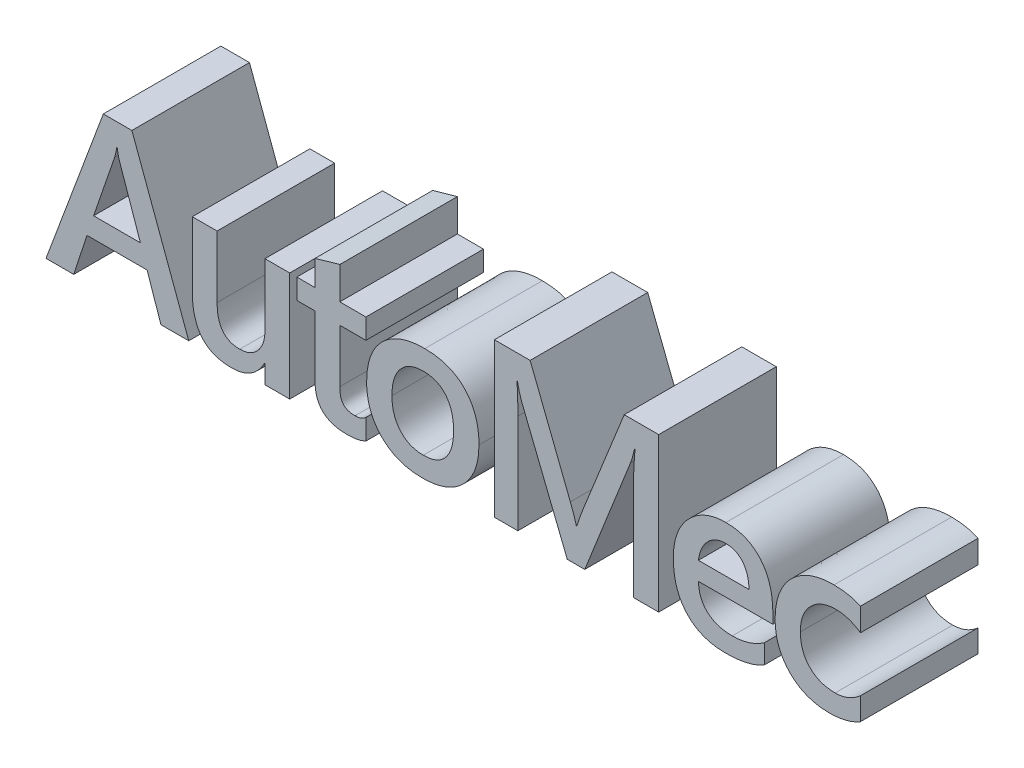
from build123d import *

# Parameters (mm, degrees)
BOSS_EXTRUDE1_DEPTH   = 26
BOSS_EXTRUDE1_2_DEPTH = 26
BOSS_EXTRUDE1_3_DEPTH = 26
BOSS_EXTRUDE1_4_DEPTH = 26
BOSS_EXTRUDE1_5_DEPTH = 26
BOSS_EXTRUDE1_6_DEPTH = 26
BOSS_EXTRUDE1_7_DEPTH = 26


with BuildPart() as part:
    # Sketch1 → Boss-Extrude1 (new body)
    with BuildSketch(Plane.XY):
        Polygon((31.965871711, 0), (25.807565789, 0), (22.766858553, 8.947368421), (9.457648026, 8.947368421), (6.535773026, 0), (0.3984375, 0), (13.071546053, 34), (19.390625, 34), align=None)
        with BuildLine():
            Line((21.277960526, 13.421052632), (16.587582237, 26.932976974))
            add(Edge.make_bspline(
                [(16.587582237, 26.932976974), (16.548101045, 27.060575153), (16.459275885, 27.347646749), (16.367014618, 27.839645061), (16.239400169, 28.423737496), (16.174856897, 28.850100474), (16.140213816, 29.078947368)],
                knots=[0, 0, 0, 0, 0.729984796, 1.642326725, 2.734537859, 4, 4, 4, 4], degree=3))
            Line((16.140213816, 29.078947368), (16.042351974, 29.078947368))
            add(Edge.make_bspline(
                [(16.042351974, 29.078947368), (16.009674078, 28.864165636), (15.947638546, 28.456425206), (15.825299172, 27.886844553), (15.710174952, 27.383968641), (15.617503708, 27.077025279), (15.574013158, 26.932976974)],
                knots=[0, 0, 0, 0, 1.185466323, 2.250482591, 3.1789527, 4, 4, 4, 4], degree=3))
            Line((15.574013158, 26.932976974), (10.925575658, 13.421052632))
            Line((10.925575658, 13.421052632), (21.277960526, 13.421052632))
        make_face(mode=Mode.SUBTRACT)
    extrude(amount=BOSS_EXTRUDE1_DEPTH)


with BuildPart() as body_2:
    # Sketch1 → Boss-Extrude1 2 (new body)
    with BuildSketch(Plane.XY):
        with BuildLine():
            Line((54.29375, 0), (48.820476974, 0))
            Line((48.820476974, 0), (48.820476974, 4.075246711))
            Line((48.820476974, 4.075246711), (48.722615132, 4.075246711))
            add(Edge.make_bspline(
                [(48.722615132, 4.075246711), (48.519935144, 3.715057326), (48.126604746, 3.016056721), (47.39560065, 2.091776269), (46.587459374, 1.308026839), (45.69578099, 0.659377738), (44.715132669, 0.162634197), (43.654651126, -0.197849774), (42.509830852, -0.409768991), (41.719402161, -0.434602531), (41.313075658, -0.447368421)],
                knots=[0, 0, 0, 0, 1.079725848, 2.095367192, 3.06949039, 4.016760712, 4.968041884, 5.93364341, 6.937772052, 8, 8, 8, 8], degree=3))
            add(Edge.make_bspline(
                [(41.313075658, -0.447368421), (40.967836418, -0.439355495), (40.296204328, -0.423767065), (39.323402019, -0.302248164), (38.411572364, -0.113138442), (37.573631593, 0.178861855), (36.794387817, 0.531364638), (36.090987822, 0.978782599), (35.447457228, 1.498940574), (34.873222706, 2.103701725), (34.3649034, 2.78825589), (33.932471092, 3.555200243), (33.568305349, 4.40217537), (33.27199471, 5.325304496), (33.030777604, 6.32693486), (32.868069359, 7.409734562), (32.770474627, 8.572757186), (32.757070793, 9.373567228), (32.750164474, 9.786184211)],
                knots=[0, 0, 0, 0, 1.084713073, 2.110212352, 3.076892847, 4.00554504, 4.893457195, 5.758981407, 6.617912711, 7.488102356, 8.372747002, 9.291062449, 10.248797554, 11.265446988, 12.334723834, 13.48333476, 14.703289464, 16, 16, 16, 16], degree=3))
            Line((32.750164474, 9.786184211), (32.750164474, 24.157894737))
            Line((32.750164474, 24.157894737), (38.2234375, 24.157894737))
            Line((38.2234375, 24.157894737), (38.2234375, 10.457236842))
            add(Edge.make_bspline(
                [(38.2234375, 10.457236842), (38.227921152, 10.198508998), (38.236656835, 9.694418861), (38.290824437, 8.963512292), (38.386108863, 8.283162461), (38.529108844, 7.655814879), (38.70017065, 7.074146206), (38.914933354, 6.540934251), (39.176398091, 6.062390631), (39.470789874, 5.633108204), (39.801388553, 5.247886169), (40.179550685, 4.920526462), (40.596762914, 4.64571346), (41.052420412, 4.41933377), (41.54412455, 4.239131733), (42.078642, 4.110713393), (42.651223063, 4.045456825), (43.046487399, 4.032807556), (43.249342105, 4.026315789)],
                knots=[0, 0, 0, 0, 1.33211556, 2.595415729, 3.771149648, 4.865479191, 5.905389678, 6.890066322, 7.81878141, 8.707263502, 9.566093683, 10.424923863, 11.273385492, 12.131796628, 13.038874263, 13.964173805, 14.955187992, 16, 16, 16, 16], degree=3))
            add(Edge.make_bspline(
                [(43.249342105, 4.026315789), (43.447702282, 4.031443284), (43.836939898, 4.04150485), (44.40863582, 4.128206474), (44.951484922, 4.267498611), (45.471948728, 4.456495826), (45.957649198, 4.709484046), (46.421276691, 5.013940546), (46.851224373, 5.379136943), (47.257586842, 5.791759516), (47.6275201, 6.247945191), (47.939226546, 6.750076446), (48.217875081, 7.277381295), (48.440348446, 7.842328422), (48.606200553, 8.445473657), (48.734490971, 9.077862697), (48.801381432, 9.747490403), (48.814013736, 10.203137507), (48.820476974, 10.436266447)],
                knots=[0, 0, 0, 0, 0.999150715, 1.960610493, 2.906092422, 3.819987555, 4.744233245, 5.659334442, 6.60947108, 7.580916613, 8.57481006, 9.561813227, 10.554388006, 11.576996797, 12.614063925, 13.703262757, 14.824889011, 16, 16, 16, 16], degree=3))
            Line((48.820476974, 10.436266447), (48.820476974, 24.157894737))
            Line((48.820476974, 24.157894737), (54.29375, 24.157894737))
            Line((54.29375, 24.157894737), (54.29375, 0))
        make_face()
    extrude(amount=BOSS_EXTRUDE1_2_DEPTH)


with BuildPart() as body_3:
    # Sketch1 → Boss-Extrude1 3 (new body)
    with BuildSketch(Plane.XY):
        with BuildLine():
            add(Edge.make_bspline(
                [(71.148355263, 0.391447368), (70.862441983, 0.262212261), (70.266015813, -0.007377176), (69.261962299, -0.266704273), (68.135503638, -0.415010239), (67.341561845, -0.436256328), (66.926315789, -0.447368421)],
                knots=[0, 0, 0, 0, 0.865864127, 1.80622609, 2.852616184, 4, 4, 4, 4], degree=3))
            add(Edge.make_bspline(
                [(66.926315789, -0.447368421), (66.641827941, -0.441976485), (66.090415955, -0.431525501), (65.292069444, -0.351932158), (64.545705264, -0.234353409), (63.859662174, -0.037245325), (63.219587354, 0.183975911), (62.642293108, 0.478393413), (62.112458994, 0.808620086), (61.648826887, 1.208441395), (61.231335916, 1.651644998), (60.867107897, 2.147747278), (60.563427287, 2.700673489), (60.324499579, 3.303888027), (60.120319749, 3.953780656), (59.997422062, 4.661163859), (59.908208741, 5.417414181), (59.89898653, 5.938985548), (59.894243421, 6.207236842)],
                knots=[0, 0, 0, 0, 1.229298507, 2.382702577, 3.465489837, 4.48920099, 5.464042504, 6.387321762, 7.284075982, 8.155768071, 9.025013382, 9.911301508, 10.808281896, 11.743349568, 12.711823935, 13.746816671, 14.84115697, 16, 16, 16, 16], degree=3))
            Line((59.894243421, 6.207236842), (59.894243421, 19.684210526))
            Line((59.894243421, 19.684210526), (55.8609375, 19.684210526))
            Line((55.8609375, 19.684210526), (55.8609375, 24.157894737))
            Line((55.8609375, 24.157894737), (59.894243421, 24.157894737))
            Line((59.894243421, 24.157894737), (59.894243421, 29.756990132))
            Line((59.894243421, 29.756990132), (65.367516447, 31.315789474))
            Line((65.367516447, 31.315789474), (65.367516447, 24.157894737))
            Line((65.367516447, 24.157894737), (71.148355263, 24.157894737))
            Line((71.148355263, 24.157894737), (71.148355263, 19.684210526))
            Line((71.148355263, 19.684210526), (65.367516447, 19.684210526))
            Line((65.367516447, 19.684210526), (65.367516447, 7.912828947))
            add(Edge.make_bspline(
                [(65.367516447, 7.912828947), (65.374850237, 7.588159983), (65.38844778, 6.986192822), (65.536911381, 6.155880793), (65.761211112, 5.461570538), (66.114551679, 4.907817754), (66.59659397, 4.495374962), (67.203704002, 4.218775229), (67.933362745, 4.051738768), (68.46080435, 4.035192189), (68.74375, 4.026315789)],
                knots=[0, 0, 0, 0, 1.301770834, 2.413607027, 3.375007823, 4.212960136, 5.015447376, 5.885665953, 6.865767099, 8, 8, 8, 8], degree=3))
            add(Edge.make_bspline(
                [(68.74375, 4.026315789), (68.968555945, 4.036632664), (69.410728871, 4.056925021), (70.046525735, 4.230108326), (70.636863761, 4.512975139), (70.975929682, 4.783488276), (71.148355263, 4.921052632)],
                knots=[0, 0, 0, 0, 1.027228491, 2.020465378, 2.993344995, 4, 4, 4, 4], degree=3))
            Line((71.148355263, 4.921052632), (71.148355263, 0.391447368))
        make_face()
    extrude(amount=BOSS_EXTRUDE1_3_DEPTH)


with BuildPart() as body_4:
    # Sketch1 → Boss-Extrude1 4 (new body)
    with BuildSketch(Plane.XY):
        with BuildLine():
            add(Edge.make_bspline(
                [(83.571217105, -0.447368421), (83.116478046, -0.435766328), (82.227645246, -0.413088881), (80.927962397, -0.261228177), (79.703137182, 0.006607153), (78.543264181, 0.367647312), (77.459612752, 0.848074703), (76.43559015, 1.417902524), (75.497499926, 2.114586968), (74.621934566, 2.891734964), (73.84104346, 3.765878229), (73.160560676, 4.713335834), (72.582280057, 5.727045524), (72.113024656, 6.810239741), (71.748142544, 7.962828332), (71.495555668, 9.183386916), (71.325787669, 10.468788131), (71.311066251, 11.349072795), (71.303536184, 11.799342105)],
                knots=[0, 0, 0, 0, 1.116215865, 2.181755126, 3.205970085, 4.189968188, 5.158030114, 6.110765013, 7.060249804, 8.020167771, 8.980085738, 9.930844381, 10.878605029, 11.839136188, 12.823134291, 13.840555896, 14.895435254, 16, 16, 16, 16], degree=3))
            add(Edge.make_bspline(
                [(71.303536184, 11.799342105), (71.314220878, 12.289102273), (71.3349896, 13.241089534), (71.497550388, 14.628486583), (71.768180659, 15.934853928), (72.150956738, 17.160258467), (72.644677732, 18.302630783), (73.238780326, 19.365546668), (73.949536427, 20.344261164), (74.770987302, 21.229681388), (75.676158327, 22.029509007), (76.671549074, 22.713633519), (77.729896897, 23.308764241), (78.871664382, 23.782724766), (80.086885278, 24.153351896), (81.378314, 24.418988882), (82.745069408, 24.570957708), (83.680354577, 24.593659861), (84.158388158, 24.605263158)],
                knots=[0, 0, 0, 0, 1.143863687, 2.223422261, 3.257839875, 4.256304326, 5.216870454, 6.160037922, 7.095256146, 8.035151121, 8.976274615, 9.910906598, 10.851416034, 11.807716392, 12.792557447, 13.815208396, 14.883331214, 16, 16, 16, 16], degree=3))
            add(Edge.make_bspline(
                [(84.158388158, 24.605263158), (84.617850734, 24.596854423), (85.51386906, 24.580456177), (86.817110317, 24.424602055), (88.043763445, 24.166945732), (89.191391663, 23.80429618), (90.263789352, 23.341556299), (91.255583369, 22.774535667), (92.164816844, 22.094660338), (92.993989506, 21.320657514), (93.739573195, 20.457633351), (94.386388525, 19.507505879), (94.929059131, 18.476183891), (95.383285084, 17.370823953), (95.719730179, 16.180360682), (95.973264602, 14.914277774), (96.119518448, 13.566617615), (96.137332542, 12.643167598), (96.146463816, 12.169819079)],
                knots=[0, 0, 0, 0, 1.124545113, 2.19302525, 3.207845701, 4.189328101, 5.13466569, 6.062314969, 6.979645247, 7.907995908, 8.834293529, 9.766265415, 10.71560516, 11.682808566, 12.686617748, 13.739403152, 14.841247334, 16, 16, 16, 16], degree=3))
            add(Edge.make_bspline(
                [(96.146463816, 12.169819079), (96.134726063, 11.703476106), (96.111830162, 10.793817996), (95.962429283, 9.462937389), (95.68370472, 8.209030284), (95.319143745, 7.018065326), (94.830010563, 5.904692311), (94.251686073, 4.850381801), (93.54722111, 3.88059887), (92.74874086, 2.983735841), (91.865108427, 2.172310538), (90.895434242, 1.470188283), (89.84968076, 0.880590266), (88.736809482, 0.388629433), (87.548338334, 0.010764151), (86.288078907, -0.251687484), (84.95492984, -0.415920265), (84.040046428, -0.436713162), (83.571217105, -0.447368421)],
                knots=[0, 0, 0, 0, 1.113330615, 2.17168539, 3.190677719, 4.175832019, 5.139908346, 6.08858641, 7.041023692, 7.994418744, 8.951134188, 9.899061883, 10.845617805, 11.811921879, 12.798754882, 13.816577622, 14.881111603, 16, 16, 16, 16], degree=3))
        make_face()
        with BuildLine():
            add(Edge.make_bspline(
                [(83.829851974, 20.131578947), (83.56863105, 20.12446461), (83.060594086, 20.110628252), (82.316663712, 20.014448035), (81.617780758, 19.836576065), (80.954687858, 19.601021464), (80.338688179, 19.291610514), (79.761972902, 18.916534488), (79.233343875, 18.466459657), (78.74347475, 17.958015842), (78.307788442, 17.387818344), (77.931851654, 16.762867498), (77.604959121, 16.088531164), (77.353646914, 15.356321889), (77.136041167, 14.581154127), (77.006106276, 13.748184142), (76.90787838, 12.868845838), (76.899786796, 12.263332003), (76.895641447, 11.953125)],
                knots=[0, 0, 0, 0, 1.034419223, 2.011795967, 2.962862038, 3.885162513, 4.792949386, 5.686082137, 6.602827649, 7.536002034, 8.47717027, 9.437677761, 10.419876795, 11.438371995, 12.499281577, 13.603559465, 14.772294546, 16, 16, 16, 16], degree=3))
            add(Edge.make_bspline(
                [(76.895641447, 11.953125), (76.900112184, 11.654609345), (76.908866125, 11.070099825), (77.003229628, 10.219925279), (77.146299088, 9.414402333), (77.358933782, 8.663434782), (77.612269348, 7.953429869), (77.948218619, 7.302372596), (78.328503158, 6.692053056), (78.772069432, 6.138709078), (79.261146454, 5.641541459), (79.793537214, 5.204828451), (80.370794677, 4.838271568), (80.990056547, 4.545819209), (81.643558484, 4.314421759), (82.335956296, 4.143741215), (83.069877085, 4.047647134), (83.57327703, 4.03351746), (83.829851974, 4.026315789)],
                knots=[0, 0, 0, 0, 1.204180082, 2.357848612, 3.447833994, 4.501816686, 5.504423492, 6.484239282, 7.452070217, 8.402198806, 9.339727465, 10.261995276, 11.175013197, 12.09189658, 13.019803471, 13.968535155, 14.964594688, 16, 16, 16, 16], degree=3))
            add(Edge.make_bspline(
                [(83.829851974, 4.026315789), (84.091136112, 4.0332465), (84.601606338, 4.046787014), (85.341343215, 4.145429359), (86.038202046, 4.305372325), (86.68352726, 4.536733819), (87.29164637, 4.822873501), (87.839907616, 5.191056991), (88.352354486, 5.611452283), (88.804031028, 6.10536083), (89.213969904, 6.654359265), (89.567848693, 7.26265404), (89.870815089, 7.924886931), (90.114452506, 8.641806516), (90.303011665, 9.413826936), (90.431415929, 10.241842607), (90.519111547, 11.124091472), (90.528538984, 11.731542985), (90.533388158, 12.043996711)],
                knots=[0, 0, 0, 0, 1.055638297, 2.062398134, 3.010235434, 3.939415019, 4.828014631, 5.718557739, 6.601050065, 7.500508731, 8.41574815, 9.365314357, 10.338626266, 11.354023461, 12.420524239, 13.545919019, 14.737698847, 16, 16, 16, 16], degree=3))
            add(Edge.make_bspline(
                [(90.533388158, 12.043996711), (90.528636186, 12.358787139), (90.519430925, 12.96858194), (90.430871287, 13.855394035), (90.303001585, 14.688072024), (90.114518838, 15.467118914), (89.870463031, 16.190722433), (89.569939733, 16.859013215), (89.211779342, 17.469346747), (88.804529745, 18.024709201), (88.352070854, 18.524479918), (87.842699556, 18.954359146), (87.287599579, 19.317701533), (86.687640215, 19.624782822), (86.037601211, 19.851324384), (85.341515764, 20.01280943), (84.601559616, 20.111014561), (84.091120294, 20.124616696), (83.829851974, 20.131578947)],
                knots=[0, 0, 0, 0, 1.265840082, 2.452116173, 3.581568067, 4.652248281, 5.671825925, 6.649173829, 7.594354862, 8.512905718, 9.415101245, 10.299547573, 11.18597808, 12.07877752, 13.003666078, 13.947126188, 14.949236727, 16, 16, 16, 16], degree=3))
        make_face(mode=Mode.SUBTRACT)
    extrude(amount=BOSS_EXTRUDE1_4_DEPTH)


with BuildPart() as body_5:
    # Sketch1 → Boss-Extrude1 5 (new body)
    with BuildSketch(Plane.XY):
        with BuildLine():
            Line((135.886759868, 0), (130.315625, 0))
            Line((130.315625, 0), (130.315625, 22.004934211))
            add(Edge.make_bspline(
                [(130.315625, 22.004934211), (130.320098386, 22.480322358), (130.329530975, 23.482726456), (130.397268758, 25.060477282), (130.501625531, 26.789691228), (130.599893243, 27.990984268), (130.651151316, 28.617598684)],
                knots=[0, 0, 0, 0, 0.861329844, 1.816201289, 2.860894294, 4, 4, 4, 4], degree=3))
            Line((130.651151316, 28.617598684), (130.553289474, 28.617598684))
            add(Edge.make_bspline(
                [(130.553289474, 28.617598684), (130.471546843, 28.272188762), (130.319765614, 27.630825231), (130.079720357, 26.753580215), (129.872815336, 26.02576574), (129.710066849, 25.603974847), (129.637582237, 25.416118421)],
                knots=[0, 0, 0, 0, 1.277912959, 2.372852416, 3.275304104, 4, 4, 4, 4], degree=3))
            Line((129.637582237, 25.416118421), (119.536842105, 0))
            Line((119.536842105, 0), (115.671299342, 0))
            Line((115.671299342, 0), (105.549588816, 25.227384868))
            add(Edge.make_bspline(
                [(105.549588816, 25.227384868), (105.475205943, 25.436387568), (105.310552917, 25.899033408), (105.092391938, 26.674672477), (104.870621411, 27.596997667), (104.725739026, 28.260794557), (104.647861842, 28.617598684)],
                knots=[0, 0, 0, 0, 0.758036603, 1.677980622, 2.751868064, 4, 4, 4, 4], degree=3))
            Line((104.647861842, 28.617598684), (104.556990132, 28.617598684))
            add(Edge.make_bspline(
                [(104.556990132, 28.617598684), (104.571083121, 28.433538974), (104.601220846, 28.039929034), (104.647037951, 27.408870305), (104.668534028, 26.697611031), (104.700012677, 25.905607709), (104.71996412, 25.031733652), (104.731025131, 24.076340829), (104.749844852, 23.041863072), (104.747129793, 22.326489768), (104.745723684, 21.956003289)],
                knots=[0, 0, 0, 0, 0.664632124, 1.421309473, 2.277635459, 3.226175416, 4.275090468, 5.42449288, 6.666164143, 8, 8, 8, 8], degree=3))
            Line((104.745723684, 21.956003289), (104.745723684, 0))
            Line((104.745723684, 0), (99.552055921, 0))
            Line((99.552055921, 0), (99.552055921, 34))
            Line((99.552055921, 34), (107.457894737, 34))
            Line((107.457894737, 34), (116.349342105, 11.351973684))
            add(Edge.make_bspline(
                [(116.349342105, 11.351973684), (116.507947926, 10.945134209), (116.801206879, 10.192896251), (117.172742356, 9.135776724), (117.465007682, 8.24973988), (117.607434406, 7.70609495), (117.670476974, 7.465460526)],
                knots=[0, 0, 0, 0, 1.275569132, 2.358501517, 3.273420907, 4, 4, 4, 4], degree=3))
            Line((117.670476974, 7.465460526), (117.789309211, 7.465460526))
            add(Edge.make_bspline(
                [(117.789309211, 7.465460526), (117.929001721, 7.882571238), (118.189904911, 8.661607389), (118.554953595, 9.746341283), (118.890181668, 10.657029259), (119.109368655, 11.203271224), (119.208305921, 11.449835526)],
                knots=[0, 0, 0, 0, 1.247784235, 2.330482053, 3.246408086, 4, 4, 4, 4], degree=3))
            Line((119.208305921, 11.449835526), (128.267516447, 34))
            Line((128.267516447, 34), (135.886759868, 34))
            Line((135.886759868, 34), (135.886759868, 0))
        make_face()
    extrude(amount=BOSS_EXTRUDE1_5_DEPTH)


with BuildPart() as body_6:
    # Sketch1 → Boss-Extrude1 6 (new body)
    with BuildSketch(Plane.XY):
        with BuildLine():
            Line((161.136513158, 10.289473684), (144.667763158, 10.289473684))
            add(Edge.make_bspline(
                [(144.667763158, 10.289473684), (144.681916181, 10.028076657), (144.709456716, 9.519421066), (144.82457735, 8.780817989), (144.987426476, 8.085979663), (145.221959693, 7.438636716), (145.507436238, 6.835556476), (145.850596895, 6.276598474), (146.262318088, 5.772566586), (146.721150037, 5.30722361), (147.24356479, 4.905416757), (147.804216141, 4.543742317), (148.416916975, 4.243128289), (149.075544659, 3.999833164), (149.779712564, 3.809549685), (150.528874831, 3.681758314), (151.322599989, 3.593167668), (151.867339054, 3.58377364), (152.147203947, 3.578947368)],
                knots=[0, 0, 0, 0, 1.106030723, 2.15223837, 3.155652007, 4.118403009, 5.056861912, 5.97255771, 6.88325983, 7.802656706, 8.728783019, 9.663304893, 10.619229044, 11.607246608, 12.627536803, 13.697993342, 14.817322111, 16, 16, 16, 16], degree=3))
            add(Edge.make_bspline(
                [(152.147203947, 3.578947368), (152.466706308, 3.585557866), (153.100457264, 3.598670161), (154.039986773, 3.706873928), (154.960477562, 3.882235416), (155.861088714, 4.125163615), (156.741146444, 4.443758804), (157.601115516, 4.828604288), (158.444068216, 5.281912603), (158.979187998, 5.636756391), (159.249177632, 5.815789474)],
                knots=[0, 0, 0, 0, 1.013618622, 2.010569713, 2.996631466, 3.984908343, 4.967192919, 5.963403465, 6.972454449, 8, 8, 8, 8], degree=3))
            Line((159.249177632, 5.815789474), (159.249177632, 1.558799342))
            add(Edge.make_bspline(
                [(159.249177632, 1.558799342), (158.964955256, 1.39813456), (158.387335665, 1.071618658), (157.459973022, 0.658955528), (156.462423321, 0.317655431), (155.398017678, 0.042623824), (154.271877804, -0.185621493), (153.07751493, -0.331546657), (151.820542132, -0.436425417), (150.9591191, -0.443665259), (150.518503289, -0.447368421)],
                knots=[0, 0, 0, 0, 0.863798221, 1.755480275, 2.681888941, 3.651212078, 4.66354657, 5.72070578, 6.834146486, 8, 8, 8, 8], degree=3))
            add(Edge.make_bspline(
                [(150.518503289, -0.447368421), (150.08464119, -0.439027879), (149.239653552, -0.422783883), (148.008418111, -0.265967549), (146.850169404, -0.007662782), (145.762341036, 0.34747033), (144.745947847, 0.803980288), (143.802374529, 1.36631826), (142.933474378, 2.03620246), (142.13137219, 2.796111076), (141.42880359, 3.661191392), (140.805941331, 4.605060083), (140.283789974, 5.635347007), (139.854754571, 6.747608084), (139.52962547, 7.943012815), (139.292624468, 9.216856054), (139.152399066, 10.575268955), (139.134043689, 11.507752474), (139.124588816, 11.988075658)],
                knots=[0, 0, 0, 0, 1.087572249, 2.118150232, 3.10619197, 4.059626329, 4.982768997, 5.894655562, 6.807384137, 7.728972193, 8.658913266, 9.595621626, 10.559880293, 11.549492996, 12.580070979, 13.661899038, 14.795641878, 16, 16, 16, 16], degree=3))
            add(Edge.make_bspline(
                [(139.124588816, 11.988075658), (139.132211118, 12.442992054), (139.147154583, 13.334852172), (139.316693161, 14.638817518), (139.569070539, 15.880291664), (139.935207523, 17.055548821), (140.404607302, 18.166120246), (140.981165023, 19.212890837), (141.660463535, 20.196374763), (142.444198684, 21.099532323), (143.296382497, 21.921130124), (144.21235488, 22.639659199), (145.176717207, 23.252576004), (146.199812675, 23.742433396), (147.267699635, 24.128408599), (148.383573375, 24.411354895), (149.553805064, 24.572366036), (150.350254926, 24.594157221), (150.756167763, 24.605263158)],
                knots=[0, 0, 0, 0, 1.135653552, 2.22644011, 3.278867653, 4.296855619, 5.295696662, 6.285544172, 7.276827928, 8.275516351, 9.267551598, 10.229262963, 11.178727018, 12.115837927, 13.056628604, 14.010861362, 14.986230084, 16, 16, 16, 16], degree=3))
            add(Edge.make_bspline(
                [(150.756167763, 24.605263158), (151.157493489, 24.59711202), (151.939966139, 24.581219587), (153.079531024, 24.421259961), (154.150795973, 24.174110453), (155.153654084, 23.823769222), (156.083786241, 23.367085319), (156.940991083, 22.803301323), (157.729017914, 22.141573402), (158.443880918, 21.383471573), (159.078566619, 20.535412052), (159.635070826, 19.609361673), (160.094605187, 18.598501658), (160.48223069, 17.514925773), (160.769319962, 16.347257288), (160.988917343, 15.107960076), (161.113561906, 13.787096413), (161.128716883, 12.880737768), (161.136513158, 12.414473684)],
                knots=[0, 0, 0, 0, 1.060061123, 2.066821994, 3.034733218, 3.961800763, 4.867871318, 5.766271274, 6.666695035, 7.581491725, 8.513821064, 9.461140289, 10.431008473, 11.443815559, 12.498263347, 13.60482883, 14.767836224, 16, 16, 16, 16], degree=3))
            Line((161.136513158, 12.414473684), (161.136513158, 10.289473684))
        make_face()
        with BuildLine():
            add(Edge.make_bspline(
                [(155.851973684, 14.315789474), (155.845936804, 14.555973572), (155.83418888, 15.02337801), (155.762305348, 15.705215489), (155.653970215, 16.346103073), (155.497926401, 16.946457546), (155.306059928, 17.505015629), (155.064256526, 18.021051624), (154.786096988, 18.498125873), (154.464496553, 18.931332217), (154.106789065, 19.319309477), (153.713164693, 19.654290274), (153.292408205, 19.946685468), (152.831965344, 20.176388998), (152.342857716, 20.359978603), (151.818926767, 20.48378942), (151.264176165, 20.562598117), (150.882269397, 20.573402382), (150.686266447, 20.578947368)],
                knots=[0, 0, 0, 0, 1.256878361, 2.445917645, 3.584559181, 4.655160571, 5.688664047, 6.670601375, 7.632575901, 8.573927598, 9.48852222, 10.387871166, 11.273979586, 12.162852259, 13.073373669, 14.002003812, 14.974584434, 16, 16, 16, 16], degree=3))
            add(Edge.make_bspline(
                [(150.686266447, 20.578947368), (150.492703819, 20.572842206), (150.111037736, 20.560804068), (149.549228177, 20.487506177), (149.015055632, 20.341873514), (148.499975017, 20.155464341), (148.010656463, 19.906579932), (147.535663383, 19.61330201), (147.09158058, 19.254763794), (146.53023715, 18.71046978), (145.903082096, 17.928296084), (145.326130519, 16.842281247), (144.886401227, 15.630755301), (144.742325768, 14.764235094), (144.667763158, 14.315789474)],
                knots=[0, 0, 0, 0, 0.731412914, 1.442197307, 2.133923827, 2.819010339, 3.507874879, 4.203900133, 4.924212601, 5.65874366, 7.155728722, 8.687831018, 10.285870704, 12, 12, 12, 12], degree=3))
            Line((144.667763158, 14.315789474), (155.851973684, 14.315789474))
        make_face(mode=Mode.SUBTRACT)
    extrude(amount=BOSS_EXTRUDE1_6_DEPTH)


with BuildPart() as body_7:
    # Sketch1 → Boss-Extrude1 7 (new body)
    with BuildSketch(Plane.XY):
        with BuildLine():
            add(Edge.make_bspline(
                [(180.479605263, 1.300164474), (180.235077982, 1.157932353), (179.745160946, 0.872966443), (178.961224669, 0.529444362), (178.150793942, 0.224313618), (177.303043288, -0.015137928), (176.427259627, -0.217523425), (175.514727748, -0.343197772), (174.572384923, -0.432491078), (173.932404336, -0.442367043), (173.608305921, -0.447368421)],
                knots=[0, 0, 0, 0, 0.945180728, 1.893695211, 2.857572795, 3.838956715, 4.836992861, 5.86061151, 6.916572732, 8, 8, 8, 8], degree=3))
            add(Edge.make_bspline(
                [(173.608305921, -0.447368421), (173.169672281, -0.439843233), (172.312573935, -0.425138875), (171.061973206, -0.255526799), (169.874070575, -0.001957245), (168.749845006, 0.363644593), (167.688937253, 0.831007419), (166.698923926, 1.410872962), (165.766446908, 2.084199857), (164.913415282, 2.867124872), (164.138976419, 3.726113541), (163.472576111, 4.661464357), (162.889161398, 5.64720509), (162.436820398, 6.708581475), (162.061284371, 7.820898265), (161.821983368, 9.002532686), (161.649266011, 10.240126744), (161.63465791, 11.088035644), (161.627220395, 11.519736842)],
                knots=[0, 0, 0, 0, 1.104432089, 2.158080981, 3.173706692, 4.161359349, 5.131159163, 6.088710264, 7.046891008, 8.023472411, 9.000477204, 9.955216849, 10.91276795, 11.880201679, 12.856694853, 13.865340236, 14.91316723, 16, 16, 16, 16], degree=3))
            add(Edge.make_bspline(
                [(161.627220395, 11.519736842), (161.63720478, 12.000294702), (161.656752617, 12.941150444), (161.831911067, 14.315388508), (162.095858747, 15.621886134), (162.492652398, 16.849080827), (162.989518468, 18.009119953), (163.607446658, 19.091881164), (164.329972398, 20.107044987), (165.163716129, 21.033455725), (166.08307623, 21.874227369), (167.091356597, 22.603592357), (168.170182184, 23.231811267), (169.331253783, 23.733118271), (170.560595417, 24.126097303), (171.864516244, 24.404681129), (173.242628462, 24.574754618), (174.18798928, 24.594949292), (174.670805921, 24.605263158)],
                knots=[0, 0, 0, 0, 1.106281174, 2.165922318, 3.185750223, 4.171754294, 5.130753209, 6.087226461, 7.037295562, 7.994987376, 8.952288216, 9.90114414, 10.855628253, 11.821687745, 12.807691816, 13.823388784, 14.888356597, 16, 16, 16, 16], degree=3))
            add(Edge.make_bspline(
                [(174.670805921, 24.605263158), (175.207609019, 24.593517547), (176.250917027, 24.570689271), (177.765751857, 24.345234749), (179.188314302, 23.996482305), (180.068777965, 23.626398239), (180.500575658, 23.444901316)],
                knots=[0, 0, 0, 0, 1.074814882, 2.08896517, 3.062788772, 4, 4, 4, 4], degree=3))
            Line((180.500575658, 23.444901316), (180.500575658, 18.342105263))
            add(Edge.make_bspline(
                [(180.500575658, 18.342105263), (180.290478549, 18.484958611), (179.876686012, 18.766312549), (179.229405181, 19.131024233), (178.570811335, 19.440402385), (177.899566606, 19.691626799), (177.219600689, 19.888667788), (176.530127704, 20.028947899), (175.828738554, 20.11574989), (175.356086412, 20.126279041), (175.118174342, 20.131578947)],
                knots=[0, 0, 0, 0, 1.05726283, 2.08231075, 3.089021343, 4.083508416, 5.062789754, 6.032949626, 7.009874318, 8, 8, 8, 8], degree=3))
            add(Edge.make_bspline(
                [(175.118174342, 20.131578947), (174.835960962, 20.124864448), (174.281175933, 20.111664848), (173.467743291, 20.007807742), (172.697140562, 19.822401692), (171.961260851, 19.580090054), (171.26875144, 19.255927357), (170.611186323, 18.861949232), (169.999049515, 18.390840787), (169.422623476, 17.862031341), (168.91073705, 17.266964158), (168.450539865, 16.632993523), (168.075240802, 15.946261746), (167.753396399, 15.224501739), (167.520588038, 14.447949531), (167.345798656, 13.632431853), (167.238049315, 12.771492339), (167.225668053, 12.184113126), (167.219325658, 11.883223684)],
                knots=[0, 0, 0, 0, 1.055538032, 2.07501394, 3.060193738, 4.016615223, 4.96809928, 5.914299052, 6.878315699, 7.852795973, 8.835079823, 9.809793944, 10.777428812, 11.757118377, 12.760634359, 13.803428427, 14.874789608, 16, 16, 16, 16], degree=3))
            add(Edge.make_bspline(
                [(167.219325658, 11.883223684), (167.226110191, 11.586996663), (167.239343792, 11.009189802), (167.340102993, 10.167823254), (167.495428507, 9.372526271), (167.733615635, 8.629733612), (168.010411215, 7.923461357), (168.38530356, 7.280526414), (168.801336029, 6.671528843), (169.293544796, 6.121612518), (169.836131327, 5.626388637), (170.427435205, 5.193712226), (171.070306896, 4.840514966), (171.748168343, 4.53558346), (172.475088032, 4.303916063), (173.246393042, 4.147261776), (174.062344286, 4.04630028), (174.621565242, 4.033092147), (174.908470395, 4.026315789)],
                knots=[0, 0, 0, 0, 1.143353521, 2.230173021, 3.267542959, 4.266240449, 5.238496168, 6.189162683, 7.132480114, 8.081996758, 9.030831338, 9.964707814, 10.903122628, 11.857612043, 12.830574993, 13.841514051, 14.892600977, 16, 16, 16, 16], degree=3))
            add(Edge.make_bspline(
                [(174.908470395, 4.026315789), (175.153513106, 4.032905261), (175.64119172, 4.046019482), (176.366753458, 4.156037511), (177.080958924, 4.329631336), (177.7846826, 4.577665903), (178.478977795, 4.894169159), (179.164083556, 5.279751112), (179.838709821, 5.734308184), (180.263385142, 6.084738856), (180.479605263, 6.263157895)],
                knots=[0, 0, 0, 0, 0.958362683, 1.907312336, 2.864763925, 3.830685642, 4.82212851, 5.846678698, 6.903653287, 8, 8, 8, 8], degree=3))
            Line((180.479605263, 6.263157895), (180.479605263, 1.300164474))
        make_face()
    extrude(amount=BOSS_EXTRUDE1_7_DEPTH)


solid = Compound([part.part, body_2.part, body_3.part, body_4.part, body_5.part, body_6.part, body_7.part])
